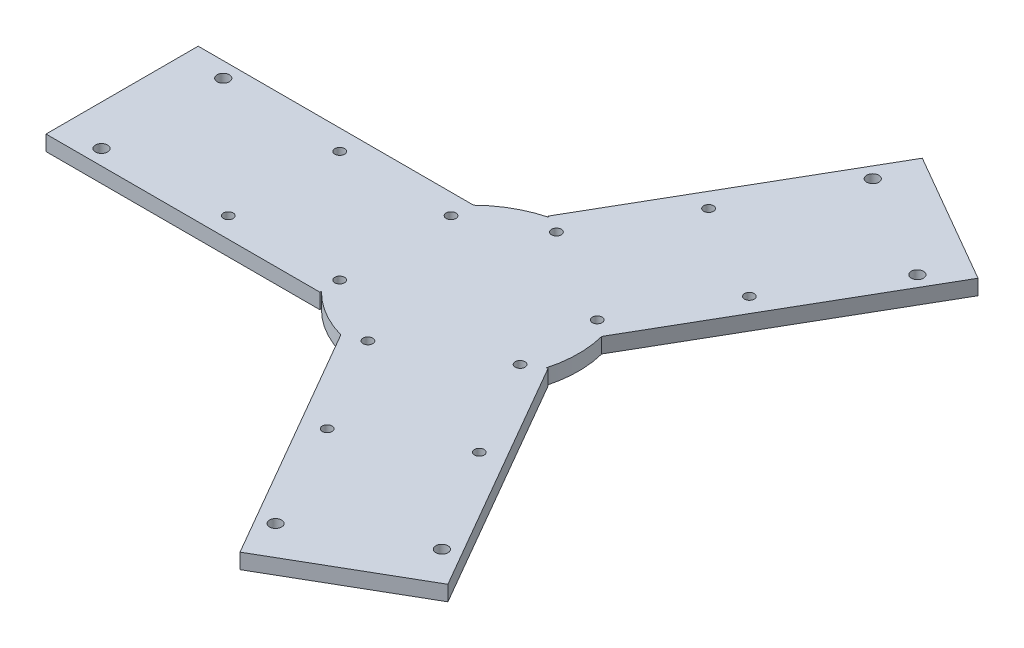
from build123d import *

# Parameters (mm, degrees)
ESQUISSE3_R             = 35
BOSS_EXTRU_3_DEPTH      = 5
ESQUISSE4_R             = 2
ESQUISSE4_R_2           = 1.6
ENL_V_MAT_EXTRU_1_DEPTH = 161.669919512


with BuildPart() as part:
    # Esquisse3 → Boss.-Extru.3 (new body)
    with BuildSketch(Plane(origin=(0, 0, 0), x_dir=(1, 0, 0), z_dir=(0, 1, 0))):
        with BuildLine():
            Line((-115, -25), (-25, -25))
            Line((-25, -25), (-24.99494949, -24.500051021))
            ThreePointArc((-24.99494949, -24.500051021), (-34.998214236, 0.353553761), (-24.494897428, 25))
            Line((-24.494897428, 25), (-25, 25))
            Line((-25, 25), (-115, 25))
            Line((-115, 25), (-115, -25))
        make_face()
        Circle(ESQUISSE3_R)
        Polygon((-9.403186381, -33.713203436), (35.849364905, -112.092921435), (79.150635095, -87.092921435), (34.150635095, -9.150635095), align=None)
        with BuildLine():
            Line((-24.494897428, 25), (-24.99494949, -24.500051021))
            ThreePointArc((-24.99494949, -24.500051021), (-17.805293657, -30.132565736), (-9.403186381, -33.713203436))
            Line((-9.403186381, -33.713203436), (33.715141323, -9.396235714))
            ThreePointArc((33.715141323, -9.396235714), (34.677297662, -4.741837919), (35, 0))
            ThreePointArc((35, 0), (34.72342821, 4.391302011), (33.898083809, 8.713203436))
            Line((33.898083809, 8.713203436), (-8.720191833, 33.896286735))
            ThreePointArc((-8.720191833, 33.896286735), (-17.19292058, 30.486119496), (-24.494897428, 25))
        make_face()
        Circle(ESQUISSE3_R)
        Polygon((33.898083809, 8.713203436), (79.150635095, 87.092921435), (35.849364905, 112.092921435), (-9.150635095, 34.150635095), align=None)
        with BuildLine():
            ThreePointArc((33.898083809, 8.713203436), (17.805293657, 30.132565736), (-8.720191833, 33.896286735))
            Line((-8.720191833, 33.896286735), (33.898083809, 8.713203436))
        make_face()
    extrude(amount=BOSS_EXTRU_3_DEPTH)

    # Esquisse4 → Enlèv. mat.-Extru.1 (cut, through all)
    with BuildSketch(Plane(origin=(0, 5, 0), x_dir=(1, 0, 0), z_dir=(0, 1, 0))):
        with Locations(Location((-101.75, 20, 0), (0, 0, 270))):
            Circle(ESQUISSE4_R)
        with Locations(Location((-101.75, -20, 0), (0, 0, 270))):
            Circle(ESQUISSE4_R)
        with Locations(Location((33.554491924, -98.118084835, 0), (0, 0, 270))):
            Circle(ESQUISSE4_R)
        with Locations(Location((68.195508076, -78.118084835, 0), (0, 0, 270))):
            Circle(ESQUISSE4_R)
        with Locations(Location((68.195508076, 78.118084835, 0), (0, 0, 270))):
            Circle(ESQUISSE4_R)
        with Locations(Location((33.554491924, 98.118084835, 0), (0, 0, 270))):
            Circle(ESQUISSE4_R)
        with Locations(Location((-3.248264889, -30.973840175, 0), (0, 0, 270))):
            Circle(ESQUISSE4_R_2)
        with Locations(Location((15.051735111, -62.670369954, 0), (0, 0, 270))):
            Circle(ESQUISSE4_R_2)
        with Locations(Location((28.448264889, -12.673840175, 0), (0, 0, 270))):
            Circle(ESQUISSE4_R_2)
        with Locations(Location((46.748264889, -44.370369954, 0), (0, 0, 270))):
            Circle(ESQUISSE4_R_2)
        with Locations(Location((28.448264889, 12.673840175, 0), (0, 0, 270))):
            Circle(ESQUISSE4_R_2)
        with Locations(Location((46.748264889, 44.370369954, 0), (0, 0, 270))):
            Circle(ESQUISSE4_R_2)
        with Locations(Location((15.051735111, 62.670369954, 0), (0, 0, 270))):
            Circle(ESQUISSE4_R_2)
        with Locations(Location((-3.248264889, 30.973840175, 0), (0, 0, 270))):
            Circle(ESQUISSE4_R_2)
        with Locations(Location((-25.2, 18.3, 0), (0, 0, 270))):
            Circle(ESQUISSE4_R_2)
        with Locations(Location((-61.8, -18.3, 0), (0, 0, 270))):
            Circle(ESQUISSE4_R_2)
        with Locations(Location((-25.2, -18.3, 0), (0, 0, 270))):
            Circle(ESQUISSE4_R_2)
        with Locations(Location((-61.8, 18.3, 0), (0, 0, 270))):
            Circle(ESQUISSE4_R_2)
    extrude(amount=-ENL_V_MAT_EXTRU_1_DEPTH, mode=Mode.SUBTRACT)


solid = part.part
